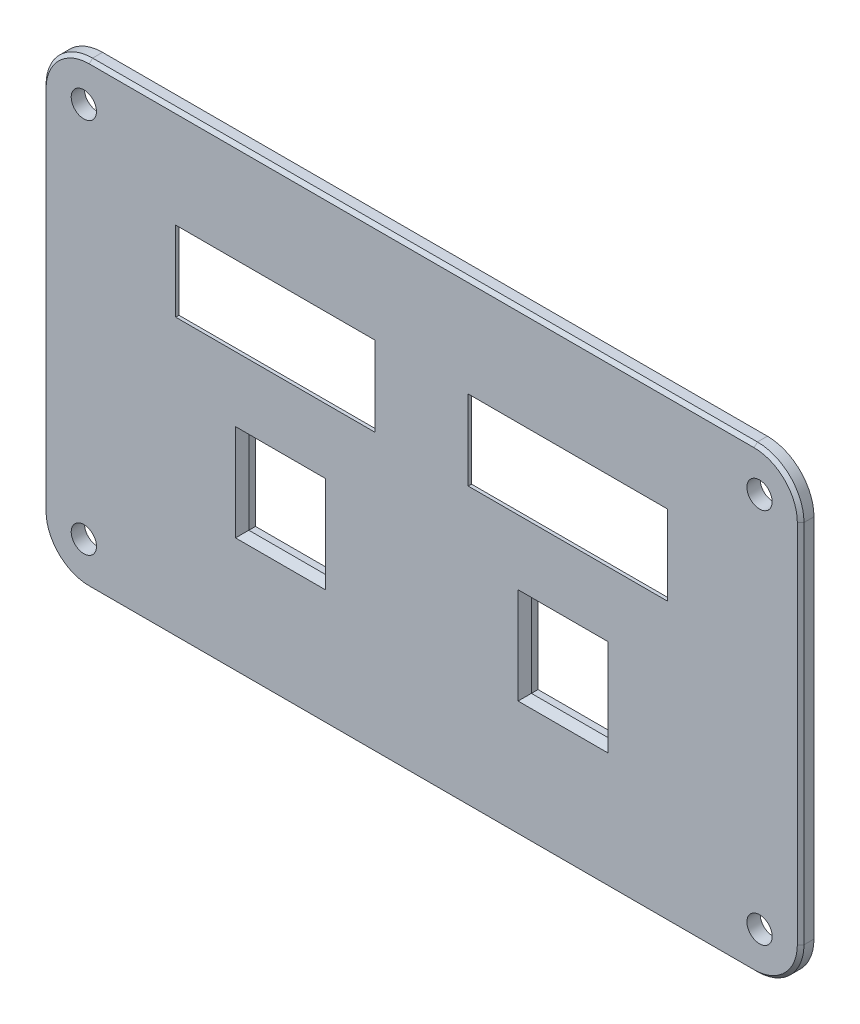
from build123d import *
from OCP.BRepFilletAPI import BRepFilletAPI_MakeChamfer

# Parameters (mm, degrees)
SKETCH1_R           = 1.9
BOSS_EXTRUDE1_DEPTH = 2
SKETCH6_W           = 11.5
SKETCH6_H           = 12.5
SKETCH6_W_2         = 30
SKETCH6_H_2         = 12
CUT_EXTRUDE2_DEPTH  = 2
CHAMFER4_SIZE       = 1
CHAMFER5_SIZE       = 1.5
CHAMFER5_SIZE2      = 2.598076211
CHAMFER6_SIZE       = 0.5


with BuildPart() as part:
    # Sketch1 → Boss-Extrude1 (new body)
    with BuildSketch(Plane.XY):
        with BuildLine():
            Line((-57, 27.5), (-57, -27.5))
            ThreePointArc((-57, -27.5), (-54.949747468, -32.449747468), (-50, -34.5))
            Line((-50, -34.5), (50, -34.5))
            ThreePointArc((50, -34.5), (54.949747468, -32.449747468), (57, -27.5))
            Line((57, -27.5), (57, 27.5))
            ThreePointArc((57, 27.5), (54.949747468, 32.449747468), (50, 34.5))
            Line((50, 34.5), (-50, 34.5))
            ThreePointArc((-50, 34.5), (-54.949747468, 32.449747468), (-57, 27.5))
        make_face()
        with Locations((-50.814035536, 28.314035536)):
            Circle(SKETCH1_R, mode=Mode.SUBTRACT)
        with Locations((50.814035536, 28.314035536)):
            Circle(SKETCH1_R, mode=Mode.SUBTRACT)
        with Locations((50.814035536, -28.314035536)):
            Circle(SKETCH1_R, mode=Mode.SUBTRACT)
        with Locations((-50.814035536, -28.314035536)):
            Circle(SKETCH1_R, mode=Mode.SUBTRACT)
    extrude(amount=BOSS_EXTRUDE1_DEPTH)

    # Sketch6 → Cut-Extrude2 (cut)
    with BuildSketch(Plane.XY.offset(2)):
        with Locations((-21.25, -9.5)):
            Rectangle(SKETCH6_W, SKETCH6_H)
        with Locations((21.25, -9.5)):
            Rectangle(SKETCH6_W, SKETCH6_H)
        with Locations((-22, 13.5)):
            Rectangle(SKETCH6_W_2, SKETCH6_H_2)
        with Locations((22, 13.5)):
            Rectangle(SKETCH6_W_2, SKETCH6_H_2)
    extrude(amount=-CUT_EXTRUDE2_DEPTH, mode=Mode.SUBTRACT)

    # Chamfer4
    chamfer4_edges = [part.edges().sort_by_distance(p)[0] for p in [
        (27, -9.5, 2),
        (21.25, -3.25, 2),
        (15.5, -9.5, 2),
        (21.25, -15.75, 2),
        (-15.5, -9.5, 2),
        (-21.25, -3.25, 2),
        (-27, -9.5, 2),
        (-21.25, -15.75, 2),
    ]]
    chamfer(chamfer4_edges, length=CHAMFER4_SIZE)

    # Chamfer5: one chamfer whose edges measure the first distance from different faces: ONE call of the kernel's chamfer builder (chamfer() names one face for all edges)
    chamfer5_edges_1 = [part.edges().sort_by_distance(p)[0] for p in [
        (-7, 13.5, 0),
    ]]
    chamfer5_side_1 = [part.faces().sort_by_distance(p)[0] for p in [
        (-7, 13.5, 1),
    ]]
    chamfer5_edges_2 = [part.edges().sort_by_distance(p)[0] for p in [
        (-22, 7.5, 0),
    ]]
    chamfer5_side_2 = [part.faces().sort_by_distance(p)[0] for p in [
        (-22, 7.5, 1),
    ]]
    chamfer5_edges_3 = [part.edges().sort_by_distance(p)[0] for p in [
        (-37, 13.5, 0),
    ]]
    chamfer5_side_3 = [part.faces().sort_by_distance(p)[0] for p in [
        (-37, 13.5, 1),
    ]]
    chamfer5_edges_4 = [part.edges().sort_by_distance(p)[0] for p in [
        (-22, 19.5, 0),
    ]]
    chamfer5_side_4 = [part.faces().sort_by_distance(p)[0] for p in [
        (-22, 19.5, 1),
    ]]
    chamfer5_edges_5 = [part.edges().sort_by_distance(p)[0] for p in [
        (37, 13.5, 0),
    ]]
    chamfer5_side_5 = [part.faces().sort_by_distance(p)[0] for p in [
        (37, 13.5, 1),
    ]]
    chamfer5_edges_6 = [part.edges().sort_by_distance(p)[0] for p in [
        (22, 7.5, 0),
    ]]
    chamfer5_side_6 = [part.faces().sort_by_distance(p)[0] for p in [
        (22, 7.5, 1),
    ]]
    chamfer5_edges_7 = [part.edges().sort_by_distance(p)[0] for p in [
        (7, 13.5, 0),
    ]]
    chamfer5_side_7 = [part.faces().sort_by_distance(p)[0] for p in [
        (7, 13.5, 1),
    ]]
    chamfer5_edges_8 = [part.edges().sort_by_distance(p)[0] for p in [
        (22, 19.5, 0),
    ]]
    chamfer5_side_8 = [part.faces().sort_by_distance(p)[0] for p in [
        (22, 19.5, 1),
    ]]
    chamfer5 = BRepFilletAPI_MakeChamfer(part.part.solid().wrapped)
    for e in chamfer5_edges_1:
        chamfer5.Add(CHAMFER5_SIZE, CHAMFER5_SIZE2, e.wrapped, chamfer5_side_1[0].wrapped)  # the first distance lies on this face
    for e in chamfer5_edges_2:
        chamfer5.Add(CHAMFER5_SIZE, CHAMFER5_SIZE2, e.wrapped, chamfer5_side_2[0].wrapped)  # the first distance lies on this face
    for e in chamfer5_edges_3:
        chamfer5.Add(CHAMFER5_SIZE, CHAMFER5_SIZE2, e.wrapped, chamfer5_side_3[0].wrapped)  # the first distance lies on this face
    for e in chamfer5_edges_4:
        chamfer5.Add(CHAMFER5_SIZE, CHAMFER5_SIZE2, e.wrapped, chamfer5_side_4[0].wrapped)  # the first distance lies on this face
    for e in chamfer5_edges_5:
        chamfer5.Add(CHAMFER5_SIZE, CHAMFER5_SIZE2, e.wrapped, chamfer5_side_5[0].wrapped)  # the first distance lies on this face
    for e in chamfer5_edges_6:
        chamfer5.Add(CHAMFER5_SIZE, CHAMFER5_SIZE2, e.wrapped, chamfer5_side_6[0].wrapped)  # the first distance lies on this face
    for e in chamfer5_edges_7:
        chamfer5.Add(CHAMFER5_SIZE, CHAMFER5_SIZE2, e.wrapped, chamfer5_side_7[0].wrapped)  # the first distance lies on this face
    for e in chamfer5_edges_8:
        chamfer5.Add(CHAMFER5_SIZE, CHAMFER5_SIZE2, e.wrapped, chamfer5_side_8[0].wrapped)  # the first distance lies on this face
    add(Compound.cast(chamfer5.Shape()), mode=Mode.REPLACE)

    # Chamfer6
    chamfer6_edges = [part.edges().sort_by_distance(p)[0] for p in [
        (57, 0, 2),
        (54.949747468, 32.449747468, 2),
        (0, 34.5, 2),
        (-54.949747468, 32.449747468, 2),
        (-57, 0, 2),
        (-54.949747468, -32.449747468, 2),
        (0, -34.5, 2),
        (54.949747468, -32.449747468, 2),
    ]]
    chamfer(chamfer6_edges, length=CHAMFER6_SIZE)


solid = part.part
